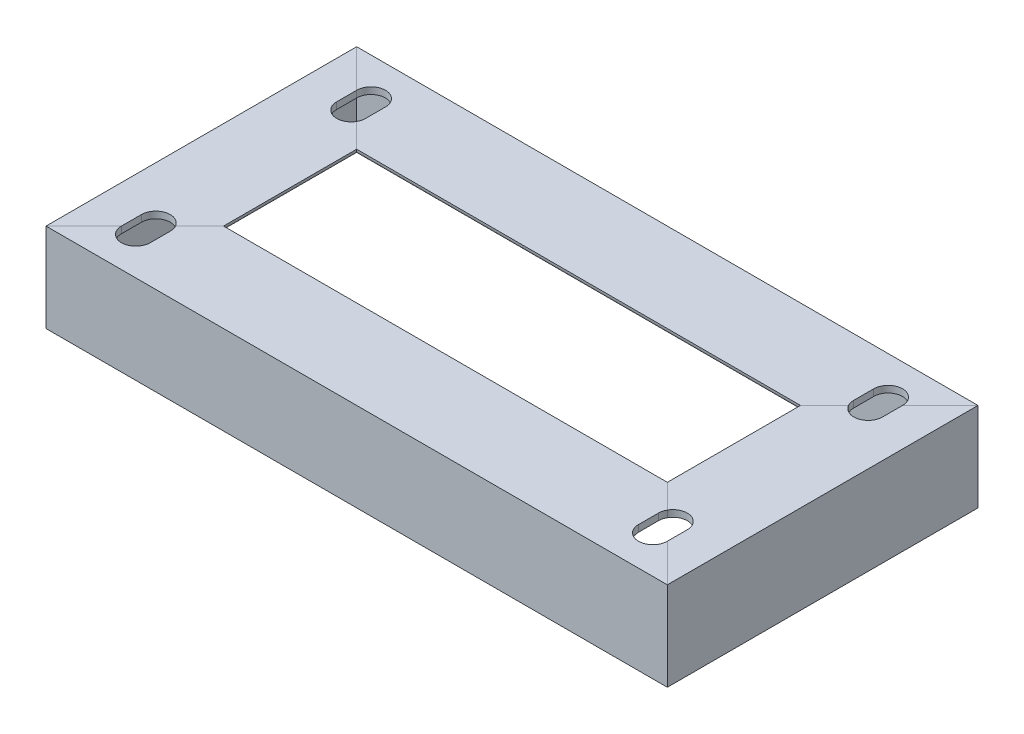
from build123d import *

# Parameters (mm, degrees)
IRON_V40X40X3_1_DEPTH      = 197.568542495
IRON_V40X40X3_1_DEPTH_BACK = 57.568542495
IRON_V40X40X3_1_2_DEPTH    = 395.13708499
IRON_V40X40X3_1_3_DEPTH    = 255.13708499
IRON_V40X40X3_1_4_DEPTH    = 395.13708499
CUT_EXTRUDE1_START         = 5
CUT_EXTRUDE1_DEPTH         = 10


with BuildPart() as part:
    # Sketch1 → Iron V40X40X3(1) (new, two sides: drawn at the far end of the back side and taken through both)
    with BuildSketch(Plane(origin=(-140, 0, 70), x_dir=(1, 0, 0), z_dir=(0, 0, -1)).offset(-IRON_V40X40X3_1_DEPTH_BACK)):
        with BuildLine():
            Line((0, 0), (0, 40))
            ThreePointArc((0, 40), (2.121320344, 39.121320344), (3, 37))
            Line((3, 37), (3, 6.5))
            ThreePointArc((3, 6.5), (4.025126266, 4.025126266), (6.5, 3))
            Line((6.5, 3), (37, 3))
            ThreePointArc((37, 3), (39.121320344, 2.121320344), (40, 0))
            Line((40, 0), (0, 0))
        make_face()
    extrude(amount=IRON_V40X40X3_1_DEPTH + IRON_V40X40X3_1_DEPTH_BACK)

    # Iron V40X40X3(1) mitre 1
    split(bisect_by=Plane(origin=(-140, 0, 70), x_dir=(0, -1, 0), z_dir=(-0.707106781, 0, -0.707106781)), keep=Keep.TOP)

    # Iron V40X40X3(1) mitre 2
    split(bisect_by=Plane(origin=(-140, 0, -70), x_dir=(0, -1, 0), z_dir=(-0.707106781, 0, 0.707106781)), keep=Keep.TOP)


with BuildPart() as body_2:
    # Sketch1 on segment 2 (carried to segment 2) → Iron V40X40X3_1 2 (new body)
    with BuildSketch(Plane(origin=(-197.568542495, 0, -70), x_dir=(0, 0, 1), z_dir=(1, 0, 0))):
        with BuildLine():
            Line((0, 0), (0, 40))
            ThreePointArc((0, 40), (2.121320344, 39.121320344), (3, 37))
            Line((3, 37), (3, 6.5))
            ThreePointArc((3, 6.5), (4.025126266, 4.025126266), (6.5, 3))
            Line((6.5, 3), (37, 3))
            ThreePointArc((37, 3), (39.121320344, 2.121320344), (40, 0))
            Line((40, 0), (0, 0))
        make_face()
    extrude(amount=IRON_V40X40X3_1_2_DEPTH)

    # Iron V40X40X3_1 2 mitre 1
    split(bisect_by=Plane(origin=(-140, 0, -70), x_dir=(0, 1, 0), z_dir=(0.707106781, 0, -0.707106781)), keep=Keep.TOP)

    # Iron V40X40X3_1 2 mitre 2
    split(bisect_by=Plane(origin=(140, 0, -70), x_dir=(0, -1, 0), z_dir=(-0.707106781, 0, -0.707106781)), keep=Keep.TOP)


with BuildPart() as body_3:
    # Sketch1 on segment 3 (carried to segment 3) → Iron V40X40X3_1 3 (new body)
    with BuildSketch(Plane(origin=(140, 0, -127.568542495), x_dir=(-1, 0, 0), z_dir=(0, 0, 1))):
        with BuildLine():
            Line((0, 0), (0, 40))
            ThreePointArc((0, 40), (2.121320344, 39.121320344), (3, 37))
            Line((3, 37), (3, 6.5))
            ThreePointArc((3, 6.5), (4.025126266, 4.025126266), (6.5, 3))
            Line((6.5, 3), (37, 3))
            ThreePointArc((37, 3), (39.121320344, 2.121320344), (40, 0))
            Line((40, 0), (0, 0))
        make_face()
    extrude(amount=IRON_V40X40X3_1_3_DEPTH)

    # Iron V40X40X3_1 3 mitre 1
    split(bisect_by=Plane(origin=(140, 0, 70), x_dir=(0, 1, 0), z_dir=(0.707106781, 0, -0.707106781)), keep=Keep.TOP)

    # Iron V40X40X3_1 3 mitre 2
    split(bisect_by=Plane(origin=(140, 0, -70), x_dir=(0, 1, 0), z_dir=(0.707106781, 0, 0.707106781)), keep=Keep.TOP)


with BuildPart() as body_4:
    # Sketch1 on segment 4 (carried to segment 4) → Iron V40X40X3_1 4 (new body)
    with BuildSketch(Plane(origin=(197.568542495, 0, 70), x_dir=(0, 0, -1), z_dir=(-1, 0, 0))):
        with BuildLine():
            Line((0, 0), (0, 40))
            ThreePointArc((0, 40), (2.121320344, 39.121320344), (3, 37))
            Line((3, 37), (3, 6.5))
            ThreePointArc((3, 6.5), (4.025126266, 4.025126266), (6.5, 3))
            Line((6.5, 3), (37, 3))
            ThreePointArc((37, 3), (39.121320344, 2.121320344), (40, 0))
            Line((40, 0), (0, 0))
        make_face()
    extrude(amount=IRON_V40X40X3_1_4_DEPTH)

    # Iron V40X40X3_1 4 mitre 1
    split(bisect_by=Plane(origin=(-140, 0, 70), x_dir=(0, 1, 0), z_dir=(0.707106781, 0, 0.707106781)), keep=Keep.TOP)

    # Iron V40X40X3_1 4 mitre 2
    split(bisect_by=Plane(origin=(140, 0, 70), x_dir=(0, -1, 0), z_dir=(-0.707106781, 0, 0.707106781)), keep=Keep.TOP)


with BuildPart() as cut_extrude1_tool:
    # Sketch2 → Cut-Extrude1 (new body)
    with BuildSketch(Plane(origin=(0, 0, 0), x_dir=(1, 0, 0), z_dir=(0, 1, 0)).offset(CUT_EXTRUDE1_START)):
        with BuildLine():
            Line((123, 53), (123, 44))
            ThreePointArc((123, 44), (116.5, 37.5), (110, 44))
            Line((110, 44), (110, 53))
            ThreePointArc((110, 53), (116.5, 59.5), (123, 53))
        make_face()
        with BuildLine():
            Line((-110, 53), (-110, 44))
            ThreePointArc((-110, 44), (-116.5, 37.5), (-123, 44))
            Line((-123, 44), (-123, 53))
            ThreePointArc((-123, 53), (-116.5, 59.5), (-110, 53))
        make_face()
        with BuildLine():
            Line((-110, -44), (-110, -53))
            ThreePointArc((-110, -53), (-116.5, -59.5), (-123, -53))
            Line((-123, -53), (-123, -44))
            ThreePointArc((-123, -44), (-116.5, -37.5), (-110, -44))
        make_face()
        with BuildLine():
            Line((123, -44), (123, -53))
            ThreePointArc((123, -53), (116.5, -59.5), (110, -53))
            Line((110, -53), (110, -44))
            ThreePointArc((110, -44), (116.5, -37.5), (123, -44))
        make_face()
    extrude(amount=-CUT_EXTRUDE1_DEPTH)


with BuildPart() as part_1:
    add(part.part)

    # Cut-Extrude1: cut by cut_extrude1_tool
    add(cut_extrude1_tool.part, mode=Mode.SUBTRACT)


with BuildPart() as body_2_1:
    add(body_2.part)

    # Cut-Extrude1: cut by cut_extrude1_tool
    add(cut_extrude1_tool.part, mode=Mode.SUBTRACT)


with BuildPart() as body_3_1:
    add(body_3.part)

    # Cut-Extrude1: cut by cut_extrude1_tool
    add(cut_extrude1_tool.part, mode=Mode.SUBTRACT)


with BuildPart() as body_4_1:
    add(body_4.part)

    # Cut-Extrude1: cut by cut_extrude1_tool
    add(cut_extrude1_tool.part, mode=Mode.SUBTRACT)


solid = Compound([part_1.part, body_2_1.part, body_3_1.part, body_4_1.part])
